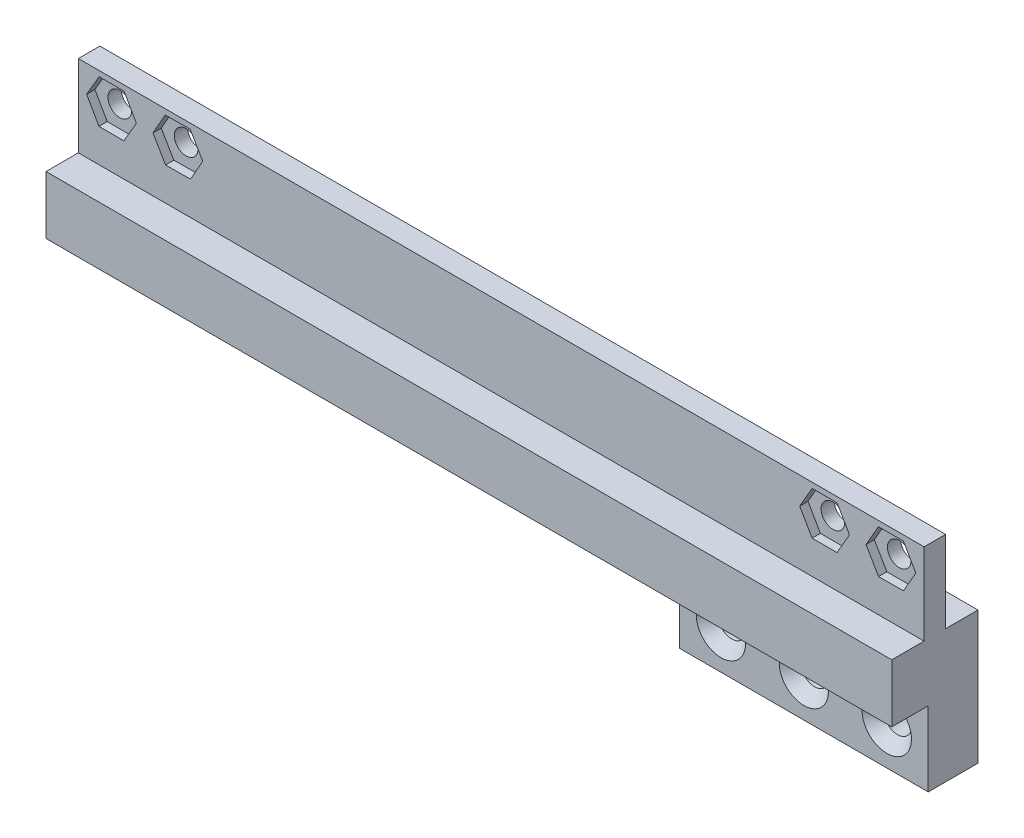
from build123d import *

# Parameters (mm, degrees)
SKETCH_1_W             = 103.5
SKETCH_1_H             = 10.4
BASE_DEPTH             = 7
SKETCH_3_W             = 30
SKETCH_3_H             = 6
FINGER_CONNECTOR_DEPTH = 9
SKETCH_5_W             = 103.5
SKETCH_5_H             = 2.6
GEAR_CONNECTOR_DEPTH   = 9.85
CUT_EXTRUDE_1_DEPTH    = 1.5
SKETCH_20_R            = 1.425
CUT_EXTRUDE_4_DEPTH    = 106.063897224
SKETCH_22_R            = 1.425
CUT_EXTRUDE_5_DEPTH    = 1
SKETCH_27_R            = 1.675
CUT_EXTRUDE_6_DEPTH    = 10
CHAMFER_2_SIZE         = 1.3


with BuildPart() as part:
    # 草图1 → Base (new body)
    with BuildSketch(Plane(origin=(0, 0, 0), x_dir=(1, 0, 0), z_dir=(0, 1, 0))):
        with Locations((51.75, -5.2)):
            Rectangle(SKETCH_1_W, SKETCH_1_H)
    extrude(amount=BASE_DEPTH)

    # 草图3 → Finger_Connector (add)
    with BuildSketch(Plane(origin=(0, 0, 0), x_dir=(-1, 0, 0), z_dir=(0, -1, 0))):
        with Locations((-88.5, -3)):
            Rectangle(SKETCH_3_W, SKETCH_3_H)
    extrude(amount=FINGER_CONNECTOR_DEPTH)

    # 草图5 → Gear Connector (add)
    with BuildSketch(Plane(origin=(0, 7, 0), x_dir=(1, 0, 0), z_dir=(0, 1, 0))):
        with Locations((51.75, -5.2)):
            Rectangle(SKETCH_5_W, SKETCH_5_H)
    extrude(amount=GEAR_CONNECTOR_DEPTH)

    # 草图6 → 切除-拉伸1 (cut)
    with BuildSketch(Plane.ZY):
        Polygon((3.9, 16.85), (3.9, 7), (0, 7), (0, 0), (10.4, 0), (10.4, 7), (6.5, 7), (6.5, 16.85), align=None)
    extrude(amount=-CUT_EXTRUDE_1_DEPTH, mode=Mode.SUBTRACT)

    # 草图20 → 切除-拉伸4 (cut, through all)
    with BuildSketch(Plane.XY.offset(6.5)):
        with Locations((13.5, 13.6)):
            Circle(SKETCH_20_R)
        with Locations((5.5, 13.6)):
            Circle(SKETCH_20_R)
        with Locations((99.5, 13.6)):
            Circle(SKETCH_20_R)
        with Locations((91.5, 13.6)):
            Circle(SKETCH_20_R)
    extrude(amount=-CUT_EXTRUDE_4_DEPTH, mode=Mode.SUBTRACT)

    # 草图22 → 切除-拉伸5 (cut)
    # profile 1 of 4: a face of its own
    with BuildSketch(Plane.XY.offset(6.5)):
        Polygon((92.998593259, 10.998548179), (94.502219993, 13.597093921), (93.003626735, 16.198545743), (90.001406741, 16.201451821), (88.497780007, 13.602906079), (89.996373265, 11.001454257), align=None)
        with Locations((91.5, 13.6)):
            Circle(SKETCH_22_R, mode=Mode.SUBTRACT)
    # profile 2 of 4: a face of its own
    with BuildSketch(Plane.XY.offset(6.5)):
        Polygon((101.010012931, 11.005160066), (102.502203767, 13.610289591), (100.992190836, 16.205129525), (97.989987069, 16.194839934), (96.497796233, 13.589710409), (98.007809164, 10.994870475), align=None)
        with Locations((99.5, 13.6)):
            Circle(SKETCH_22_R, mode=Mode.SUBTRACT)
    # profile 3 of 4: a face of its own
    with BuildSketch(Plane.XY.offset(6.5)):
        Polygon((15.023964186, 11.013329071), (16.502104828, 13.626456235), (14.978140642, 16.213127164), (11.976035814, 16.186670929), (10.497895172, 13.573543765), (12.021859358, 10.986872836), align=None)
        with Locations((13.5, 13.6)):
            Circle(SKETCH_22_R, mode=Mode.SUBTRACT)
    # profile 4 of 4: a face of its own
    with BuildSketch(Plane.XY.offset(6.5)):
        Polygon((6.985197547, 10.99087724), (8.502165366, 13.581657426), (7.016967818, 16.190780186), (4.014802453, 16.20912276), (2.497834634, 13.618342574), (3.983032182, 11.009219814), align=None)
        with Locations((5.5, 13.6)):
            Circle(SKETCH_22_R, mode=Mode.SUBTRACT)
    extrude(amount=-CUT_EXTRUDE_5_DEPTH, mode=Mode.SUBTRACT)

    # 草图27 → 切除-拉伸6 (cut)
    with BuildSketch(Plane.XY.offset(6)):
        with Locations((98.5, -4.5)):
            Circle(SKETCH_27_R)
        with Locations((88.5, -4.5)):
            Circle(SKETCH_27_R)
        with Locations((78.5, -4.5)):
            Circle(SKETCH_27_R)
    extrude(amount=-CUT_EXTRUDE_6_DEPTH, mode=Mode.SUBTRACT)

    # 倒角2
    chamfer_2_edges = [part.edges().sort_by_distance(p)[0] for p in [
        (76.825, -4.5, 6),
        (86.825, -4.5, 6),
        (96.825, -4.5, 6),
    ]]
    chamfer(chamfer_2_edges, length=CHAMFER_2_SIZE)


solid = part.part
